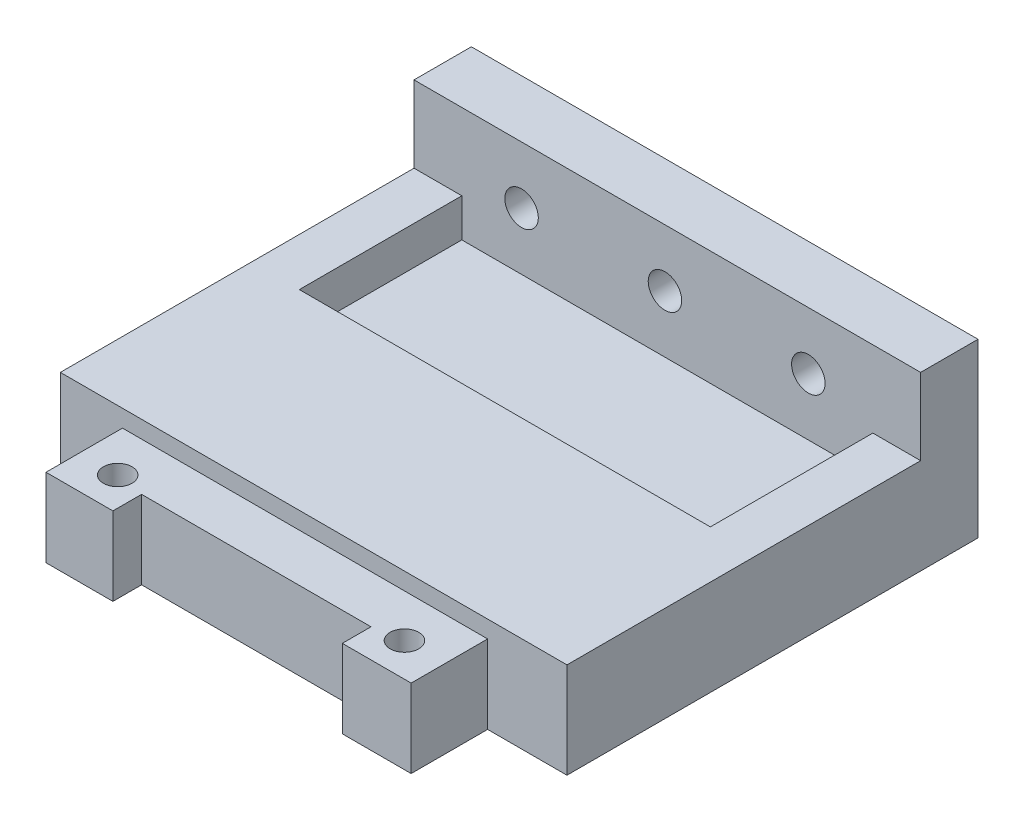
from build123d import *

# Parameters (mm, degrees)
SKETCH2_W           = 53
SKETCH2_H           = 43
BOSS_EXTRUDE1_DEPTH = 10
SKETCH3_W           = 38.2
SKETCH3_H           = 8.2
BOSS_EXTRUDE2_DEPTH = 8
SKETCH4_W           = 24
SKETCH4_H           = 8.2
CUT_EXTRUDE1_DEPTH  = 3
SKETCH5_R           = 1.5
CUT_EXTRUDE2_DEPTH  = 69.740381145
SKETCH6_W           = 53
SKETCH6_H           = 6
BOSS_EXTRUDE4_DEPTH = 8
SKETCH7_R           = 1.75
CUT_EXTRUDE3_DEPTH  = 76.723180071
SKETCH8_W           = 43
SKETCH8_H           = 17
CUT_EXTRUDE4_DEPTH  = 4


with BuildPart() as part:
    # Sketch2 → Boss-Extrude1 (new body)
    with BuildSketch(Plane(origin=(0, 0, 0), x_dir=(1, 0, 0), z_dir=(0, 1, 0))):
        with Locations((26.5, 21.5)):
            Rectangle(SKETCH2_W, SKETCH2_H)
    extrude(amount=BOSS_EXTRUDE1_DEPTH)

    # Sketch3 → Boss-Extrude2 (add)
    with BuildSketch(Plane.XY):
        with Locations((25.59901915, 4.1)):
            Rectangle(SKETCH3_W, SKETCH3_H)
    extrude(amount=BOSS_EXTRUDE2_DEPTH)

    # Sketch4 → Cut-Extrude1 (cut)
    with BuildSketch(Plane.XY.offset(8)):
        with Locations((25.49901915, 4.1)):
            Rectangle(SKETCH4_W, SKETCH4_H)
    extrude(amount=-CUT_EXTRUDE1_DEPTH, mode=Mode.SUBTRACT)

    # Sketch5 → Cut-Extrude2 (cut, through all)
    with BuildSketch(Plane(origin=(0, 8.2, 0), x_dir=(1, 0, 0), z_dir=(0, 1, 0))):
        with Locations(Location((40.49901915, -4.5, 0), (0, 0, 270))):
            Circle(SKETCH5_R)
        with Locations(Location((10.49901915, -4.5, 0), (0, 0, 270))):
            Circle(SKETCH5_R)
    extrude(amount=-CUT_EXTRUDE2_DEPTH, mode=Mode.SUBTRACT)

    # Sketch6 → Boss-Extrude4 (add)
    with BuildSketch(Plane(origin=(0, 10, 0), x_dir=(1, 0, 0), z_dir=(0, 1, 0))):
        with Locations((26.5, 40)):
            Rectangle(SKETCH6_W, SKETCH6_H)
    extrude(amount=BOSS_EXTRUDE4_DEPTH)

    # Sketch7 → Cut-Extrude3 (cut, through all)
    with BuildSketch(Plane(origin=(0, 0, -43), x_dir=(-1, 0, 0), z_dir=(0, 0, -1))):
        with Locations((-41.25, 12)):
            Circle(SKETCH7_R)
        with Locations((-26.25, 12)):
            Circle(SKETCH7_R)
        with Locations((-11.25, 12)):
            Circle(SKETCH7_R)
    extrude(amount=-CUT_EXTRUDE3_DEPTH, mode=Mode.SUBTRACT)

    # Sketch8 → Cut-Extrude4 (cut)
    with BuildSketch(Plane(origin=(0, 10, 0), x_dir=(1, 0, 0), z_dir=(0, 1, 0))):
        with Locations((26.5, 28.5)):
            Rectangle(SKETCH8_W, SKETCH8_H)
    extrude(amount=-CUT_EXTRUDE4_DEPTH, mode=Mode.SUBTRACT)


solid = part.part
